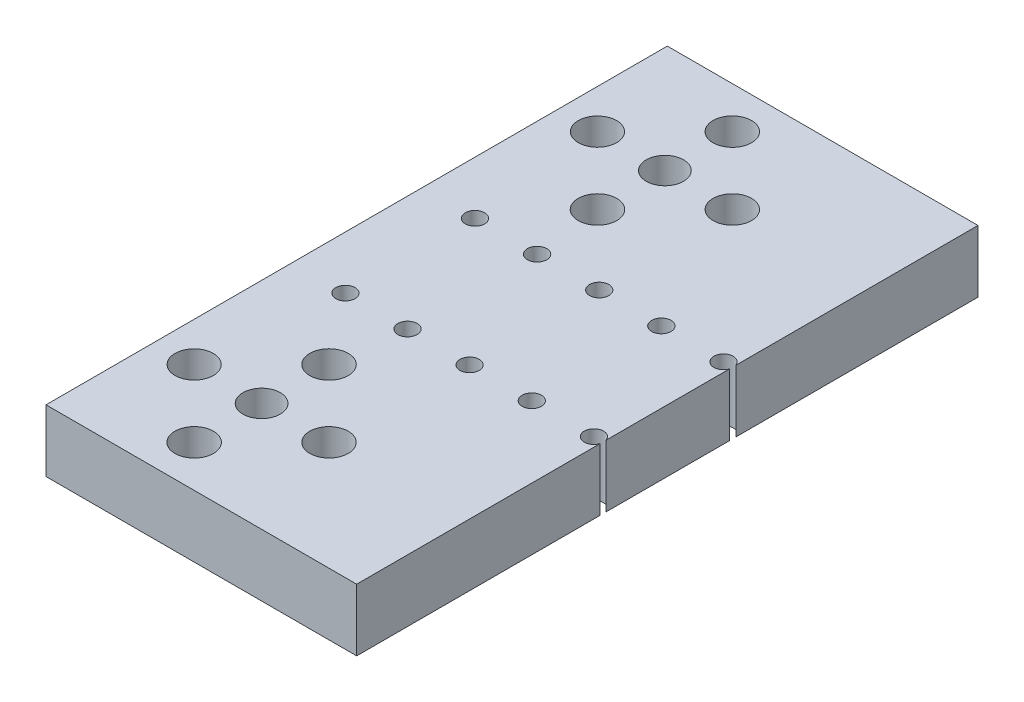
from build123d import *

# Parameters (mm, degrees)
SKETCH1_W               = 50
SKETCH1_H               = 100
BOSS_EXTRUDE1_DEPTH     = 10
CUT_EXTRUDE1_DEPTH      = 72.414284285
CUT_EXTRUDE1_DEPTH_BACK = 72.414284285
SKETCH2_R               = 3.104362215
SKETCH2_R_2             = 3.085158395
SKETCH2_R_3             = 3.1
SKETCH2_R_4             = 3.004524649
CUT_EXTRUDE2_DEPTH      = 72.414284285
CUT_EXTRUDE2_DEPTH_BACK = 72.414284285
SKETCH4_R               = 1.557412487
SKETCH4_R_2             = 1.55


with BuildPart() as part:
    # Sketch1 → Boss-Extrude1 (new body)
    with BuildSketch(Plane(origin=(0, 0, 0), x_dir=(1, 0, 0), z_dir=(0, 1, 0))):
        with Locations((-25, 0)):
            Rectangle(SKETCH1_W, SKETCH1_H)
    extrude(amount=BOSS_EXTRUDE1_DEPTH)

    # Sketch2 → Cut-Extrude1 (cut, two sides: drawn at the far end of the back side and taken through both)
    with BuildSketch(Plane(origin=(0, 10, 0), x_dir=(1, 0, 0), z_dir=(0, 1, 0)).offset(-CUT_EXTRUDE1_DEPTH_BACK)):
        with Locations(Location((-32.847308623, -43.305370298, 0), (0, 0, 270))):
            Circle(SKETCH2_R)
        with Locations(Location((-43.698787397, -32.453891525, 0), (0, 0, 270))):
            Circle(SKETCH2_R_2)
        with Locations(Location((-21.99582985, -32.453891525, 0), (0, 0, 270))):
            Circle(SKETCH2_R_3)
        with Locations(Location((-32.847308623, -21.602412752, 0), (0, 0, 270))):
            Circle(SKETCH2_R)
        with Locations(Location((-32.847308623, -32.453891525, 0), (0, 0, 270))):
            Circle(SKETCH2_R_4)
        with Locations(Location((-32.847308623, 32.453891525, 0), (0, 0, 270))):
            Circle(SKETCH2_R_4)
        with Locations(Location((-32.847308623, 21.602412752, 0), (0, 0, 270))):
            Circle(SKETCH2_R)
        with Locations(Location((-21.99582985, 32.453891525, 0), (0, 0, 270))):
            Circle(SKETCH2_R_3)
        with Locations(Location((-43.698787397, 32.453891525, 0), (0, 0, 270))):
            Circle(SKETCH2_R_2)
        with Locations(Location((-32.847308623, 43.305370298, 0), (0, 0, 270))):
            Circle(SKETCH2_R)
    extrude(amount=CUT_EXTRUDE1_DEPTH + CUT_EXTRUDE1_DEPTH_BACK, mode=Mode.SUBTRACT)

    # Sketch4 → Cut-Extrude2 (cut, two sides: drawn at the far end of the back side and taken through both)
    with BuildSketch(Plane(origin=(0, 10, 0), x_dir=(1, 0, 0), z_dir=(0, 1, 0)).offset(-CUT_EXTRUDE2_DEPTH_BACK)):
        with Locations(Location((-41.474384237, 10.515205344, 0), (0, 0, 270))):
            Circle(SKETCH4_R)
        with Locations(Location((-41.474384237, -10.343457517, 0), (0, 0, 270))):
            Circle(SKETCH4_R_2)
        with Locations(Location((-31.474384237, -10.343457517, 0), (0, 0, 270))):
            Circle(SKETCH4_R_2)
        with Locations(Location((-31.474384237, 10.515205344, 0), (0, 0, 270))):
            Circle(SKETCH4_R)
        with Locations(Location((-21.474384237, 10.515205344, 0), (0, 0, 270))):
            Circle(SKETCH4_R_2)
        with Locations(Location((-21.474384237, -10.343457517, 0), (0, 0, 270))):
            Circle(SKETCH4_R_2)
        with Locations(Location((-11.474384237, -10.343457517, 0), (0, 0, 270))):
            Circle(SKETCH4_R_2)
        with Locations((-1.474384237, -10.343457517)):
            Circle(SKETCH4_R_2)
        with Locations(Location((-11.474384237, 10.515205344, 0), (0, 0, 270))):
            Circle(SKETCH4_R)
        with Locations((-1.474384237, 10.515205344)):
            Circle(SKETCH4_R)
    extrude(amount=CUT_EXTRUDE2_DEPTH + CUT_EXTRUDE2_DEPTH_BACK, mode=Mode.SUBTRACT)


solid = part.part
